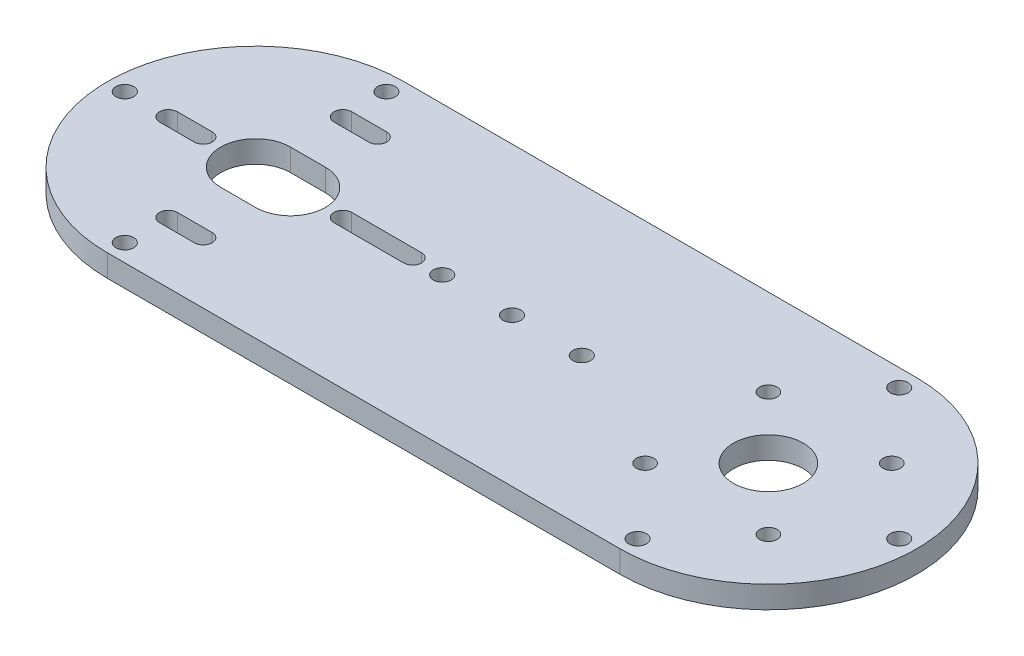
from build123d import *

# Parameters (mm, degrees)
SKETCH1_R           = 2.55
SKETCH1_R_2         = 2.5
SKETCH1_R_3         = 10
BOSS_EXTRUDE1_DEPTH = 6.35


with BuildPart() as part:
    # Sketch1 → Boss-Extrude1 (new body)
    with BuildSketch(Plane(origin=(0, 0, 0), x_dir=(1, 0, 0), z_dir=(0, 1, 0))):
        with BuildLine():
            ThreePointArc((-147, 42.5), (-189.5, 0), (-147, -42.5))
            Line((-147, -42.5), (0, -42.5))
            ThreePointArc((0, -42.5), (42.5, 0), (0, 42.5))
            Line((0, 42.5), (-147, 42.5))
        make_face()
        with BuildLine():
            Line((-122, 2.55), (-102, 2.55))
            ThreePointArc((-102, 2.55), (-99.45, 0), (-102, -2.55))
            Line((-102, -2.55), (-122, -2.55))
            ThreePointArc((-122, -2.55), (-124.55, 0), (-122, 2.55))
        make_face(mode=Mode.SUBTRACT)
        with Locations(Location((-147, -37.5, 0), (0, 0, 270))):
            Circle(SKETCH1_R, mode=Mode.SUBTRACT)
        with BuildLine():
            ThreePointArc((-147, -27.55), (-149.55, -25), (-147, -22.45))
            Line((-147, -22.45), (-137, -22.45))
            ThreePointArc((-137, -22.45), (-134.45, -25), (-137, -27.55))
            Line((-137, -27.55), (-147, -27.55))
        make_face(mode=Mode.SUBTRACT)
        with Locations(Location((-184.5, 0, 0), (0, 0, 270))):
            Circle(SKETCH1_R, mode=Mode.SUBTRACT)
        with BuildLine():
            ThreePointArc((-172, -2.55), (-174.55, 0), (-172, 2.55))
            Line((-172, 2.55), (-162, 2.55))
            ThreePointArc((-162, 2.55), (-159.45, 0), (-162, -2.55))
            Line((-162, -2.55), (-172, -2.55))
        make_face(mode=Mode.SUBTRACT)
        with BuildLine():
            ThreePointArc((-147, -10), (-157, 0), (-147, 10))
            Line((-147, 10), (-137, 10))
            ThreePointArc((-137, 10), (-127, 0), (-137, -10))
            Line((-137, -10), (-147, -10))
        make_face(mode=Mode.SUBTRACT)
        with BuildLine():
            ThreePointArc((-147, 22.45), (-149.55, 25), (-147, 27.55))
            Line((-147, 27.55), (-137, 27.55))
            ThreePointArc((-137, 27.55), (-134.45, 25), (-137, 22.45))
            Line((-137, 22.45), (-147, 22.45))
        make_face(mode=Mode.SUBTRACT)
        with Locations(Location((-147, 37.5, 0), (0, 0, 270))):
            Circle(SKETCH1_R, mode=Mode.SUBTRACT)
        with Locations(Location((-73.5, 0, 0), (0, 0, 270))):
            Circle(SKETCH1_R, mode=Mode.SUBTRACT)
        with Locations(Location((-53.5, 0, 0), (0, 0, 270))):
            Circle(SKETCH1_R, mode=Mode.SUBTRACT)
        with Locations(Location((-93.5, 0, 0), (0, 0, 270))):
            Circle(SKETCH1_R, mode=Mode.SUBTRACT)
        with Locations(Location((0, 37.5, 0), (0, 0, 270))):
            Circle(SKETCH1_R, mode=Mode.SUBTRACT)
        with Locations(Location((0, -37.5, 0), (0, 0, 270))):
            Circle(SKETCH1_R, mode=Mode.SUBTRACT)
        with Locations(Location((-17.67766953, -17.67766953, 0), (0, 0, 270))):
            Circle(SKETCH1_R_2, mode=Mode.SUBTRACT)
        with Locations(Location((17.67766953, -17.67766953, 0), (0, 0, 270))):
            Circle(SKETCH1_R_2, mode=Mode.SUBTRACT)
        with Locations(Location((-17.67766953, 17.67766953, 0), (0, 0, 270))):
            Circle(SKETCH1_R_2, mode=Mode.SUBTRACT)
        with Locations(Location((0, 0, 0), (0, 0, 270))):
            Circle(SKETCH1_R_3, mode=Mode.SUBTRACT)
        with Locations(Location((37.5, 0, 0), (0, 0, 270))):
            Circle(SKETCH1_R, mode=Mode.SUBTRACT)
        with Locations(Location((17.67766953, 17.67766953, 0), (0, 0, 270))):
            Circle(SKETCH1_R_2, mode=Mode.SUBTRACT)
    extrude(amount=-BOSS_EXTRUDE1_DEPTH)


solid = part.part
